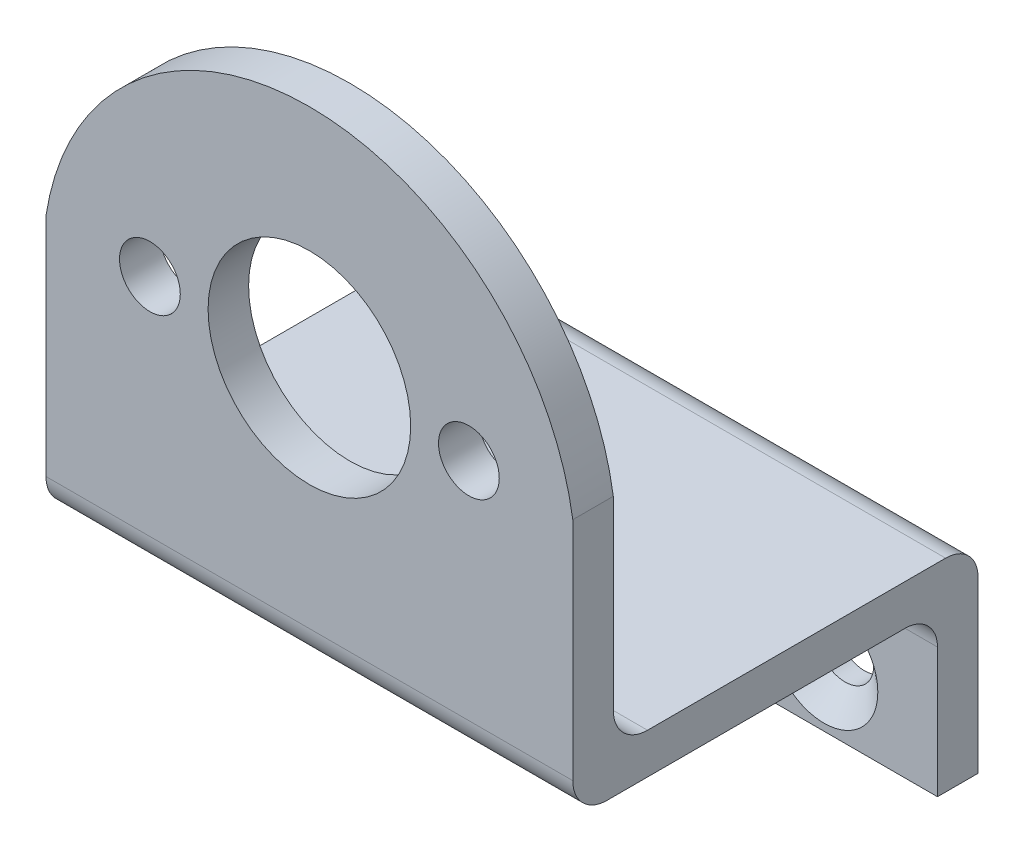
from build123d import *

# Parameters (mm, degrees)
BOSS_EXTRUDE1_DEPTH                       = 41.275
SKETCH3_R                                 = 7.9375
CUT_EXTRUDE2_DEPTH                        = 6.35
SKETCH4_R                                 = 2.38125
CUT_EXTRUDE3_DEPTH                        = 67.959870826
CSK_FOR_8_FLAT_HEAD_MACHINE_SCREW_2_COUNT = 2
CSK_FOR_8_FLAT_HEAD_MACHINE_SCREW_2_PITCH = 23.495


with BuildPart() as part:
    # Sketch1 → Boss-Extrude1 (new body)
    with BuildSketch(Plane(origin=(0, 0, 0), x_dir=(0, 0, -1), z_dir=(1, 0, 0))):
        with BuildLine():
            Line((0, 42.094372261), (0, 9.850328802))
            ThreePointArc((0, 9.850328802), (0.785233991, 7.954606252), (2.680956542, 7.169372261))
            Line((2.680956542, 7.169372261), (26.035, 7.169372261))
            ThreePointArc((26.035, 7.169372261), (27.831051224, 6.425423485), (28.575, 4.629372261))
            Line((28.575, 4.629372261), (28.575, -8.705627739))
            Line((28.575, -8.705627739), (25.4, -8.705627739))
            Line((25.4, -8.705627739), (25.4, 1.454372261))
            ThreePointArc((25.4, 1.454372261), (24.656051224, 3.250423485), (22.86, 3.994372261))
            Line((22.86, 3.994372261), (-0.494043458, 3.994372261))
            ThreePointArc((-0.494043458, 3.994372261), (-2.389766009, 4.779606252), (-3.175, 6.675328802))
            Line((-3.175, 6.675328802), (-3.175, 42.094372261))
            Line((-3.175, 42.094372261), (0, 42.094372261))
        make_face()
    extrude(amount=BOSS_EXTRUDE1_DEPTH)

    # Sketch3 → Cut-Extrude2 (cut)
    with BuildSketch(Plane.XY.offset(3.175)):
        with Locations((20.6375, 24.384850532)):
            Circle(SKETCH3_R)
    extrude(amount=-CUT_EXTRUDE2_DEPTH, mode=Mode.SUBTRACT)

    # Sketch4 → Cut-Extrude3 (cut, through all)
    with BuildSketch(Plane.XY.offset(3.175)):
        with BuildLine():
            Line((0, 42.094372261), (0, 24.384850532))
            ThreePointArc((0, 24.384850532), (7.04031678, 37.060079652), (20.6375, 42.094372261))
            Line((20.6375, 42.094372261), (0, 42.094372261))
        make_face()
        with BuildLine():
            Line((41.275, 42.094372261), (20.6375, 42.094372261))
            ThreePointArc((20.6375, 42.094372261), (34.23468322, 37.060079652), (41.275, 24.384850532))
            Line((41.275, 24.384850532), (41.275, 42.094372261))
        make_face()
        with Locations((8.14050126, 24.314372261)):
            Circle(SKETCH4_R)
        with Locations((33.13410126, 24.314372261)):
            Circle(SKETCH4_R)
    extrude(amount=-CUT_EXTRUDE3_DEPTH, mode=Mode.SUBTRACT)

    # Sketch10 → CSK for #8 Flat Head Machine Screw (100)2 (revolve, cut)
    with BuildSketch(Plane(origin=(8.89, -3.943127739, -25.4), x_dir=(0, -1, 0), z_dir=(1, 0, 0))):
        Polygon((0, 0), (0, 3.175), (2.2479, 3.175), (2.2479, 1.651767624), (4.2164, 0), align=None)
    csk_for_8_flat_head_machine_screw_100 = revolve(axis=Axis((8.89, -3.943127739, -19.05), (0, 0, -1)), mode=Mode.SUBTRACT)

    # CSK for _8 Flat Head Machine Screw _ 2: CSK for #8 Flat Head Machine Screw (100)2 ×2
    with Locations(*[(i * CSK_FOR_8_FLAT_HEAD_MACHINE_SCREW_2_PITCH, 0, 0) for i in range(1, CSK_FOR_8_FLAT_HEAD_MACHINE_SCREW_2_COUNT)]):
        add(csk_for_8_flat_head_machine_screw_100, mode=Mode.SUBTRACT)


solid = part.part
